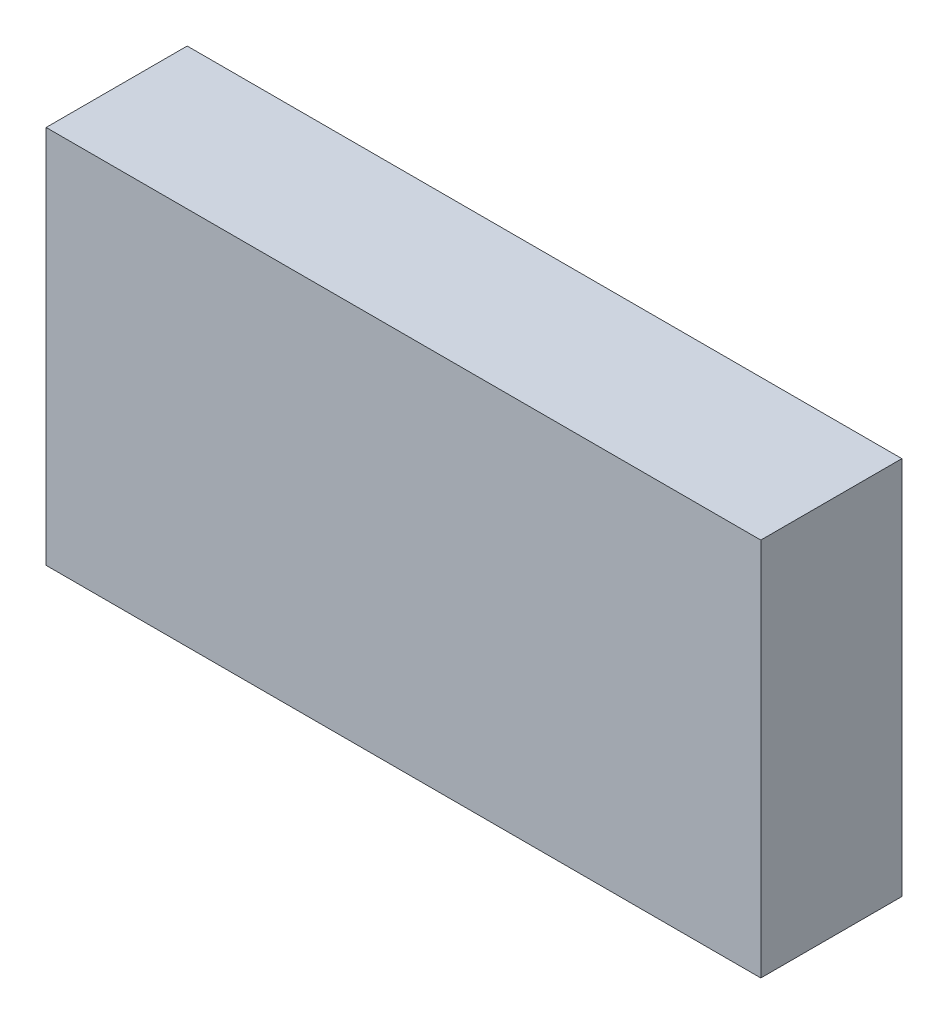
from build123d import *

# Parameters (mm, degrees)
SKETCH1_W           = 50.665440773
SKETCH1_H           = 26.886564947
BOSS_EXTRUDE1_DEPTH = 10


with BuildPart() as part:
    # Sketch1 → Boss-Extrude1 (new body)
    with BuildSketch(Plane.XY):
        with Locations((0.953934393, -0.291602338)):
            Rectangle(SKETCH1_W, SKETCH1_H)
    extrude(amount=BOSS_EXTRUDE1_DEPTH)


solid = part.part
